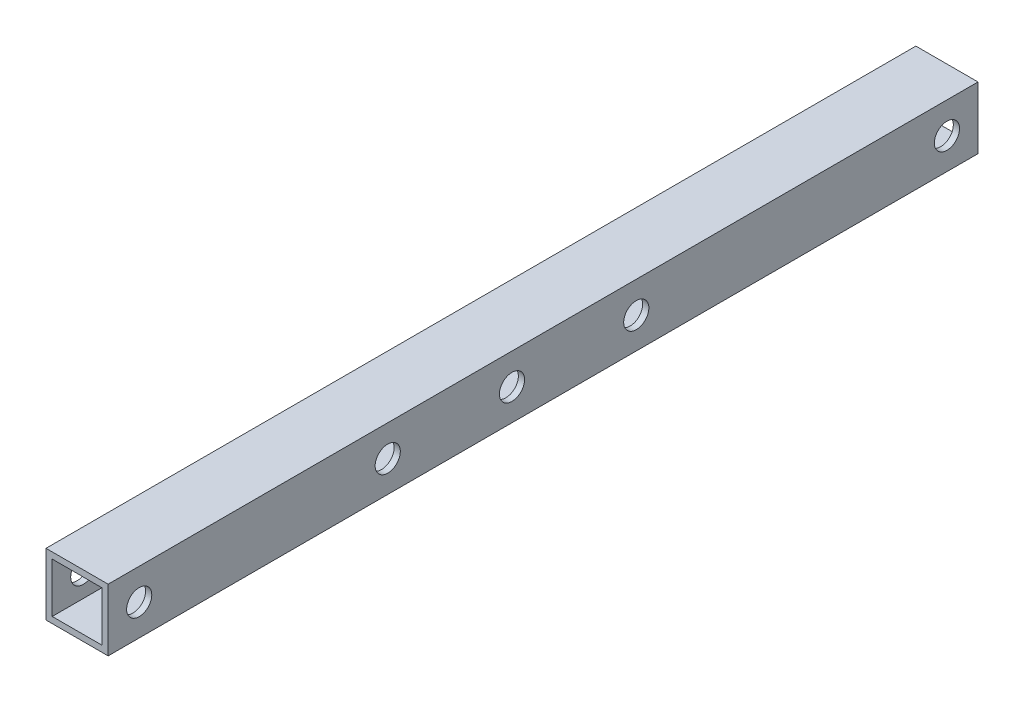
from build123d import *

# Parameters (mm, degrees)
SKETCH1_W           = 10
SKETCH1_H           = 10
SKETCH1_W_2         = 8
SKETCH1_H_2         = 8
BOSS_EXTRUDE1_DEPTH = 140
SKETCH2_R           = 2.025
CUT_EXTRUDE1_DEPTH  = 141.445719052
SKETCH3_R           = 2.025
CUT_EXTRUDE2_DEPTH  = 141.445719052
SKETCH4_R           = 2.025
CUT_EXTRUDE3_DEPTH  = 141.445719052


with BuildPart() as part:
    # Sketch1 → Boss-Extrude1 (new body)
    with BuildSketch(Plane.XY):
        Rectangle(SKETCH1_W, SKETCH1_H)
        Rectangle(SKETCH1_W_2, SKETCH1_H_2, mode=Mode.SUBTRACT)
    extrude(amount=BOSS_EXTRUDE1_DEPTH)

    # Sketch2 → Cut-Extrude1 (cut, through all)
    with BuildSketch(Plane(origin=(5, 0, 0), x_dir=(0, 0, -1), z_dir=(1, 0, 0))):
        with Locations(Location((-5, 0, 0), (0, 0, 90))):
            Circle(SKETCH2_R)
    extrude(amount=-CUT_EXTRUDE1_DEPTH, mode=Mode.SUBTRACT)

    # Sketch3 → Cut-Extrude2 (cut, through all)
    with BuildSketch(Plane(origin=(5, 0, 0), x_dir=(0, 0, -1), z_dir=(1, 0, 0))):
        with Locations(Location((-75, 0, 0), (0, 0, 90))):
            Circle(SKETCH3_R)
        with Locations(Location((-55, 0, 0), (0, 0, 90))):
            Circle(SKETCH3_R)
    extrude(amount=-CUT_EXTRUDE2_DEPTH, mode=Mode.SUBTRACT)

    # Sketch4 → Cut-Extrude3 (cut, through all)
    with BuildSketch(Plane(origin=(5, 0, 0), x_dir=(0, 0, -1), z_dir=(1, 0, 0))):
        with Locations(Location((-135, 0, 0), (0, 0, 90))):
            Circle(SKETCH4_R)
        with Locations(Location((-95, 0, 0), (0, 0, 90))):
            Circle(SKETCH4_R)
    extrude(amount=-CUT_EXTRUDE3_DEPTH, mode=Mode.SUBTRACT)


solid = part.part
